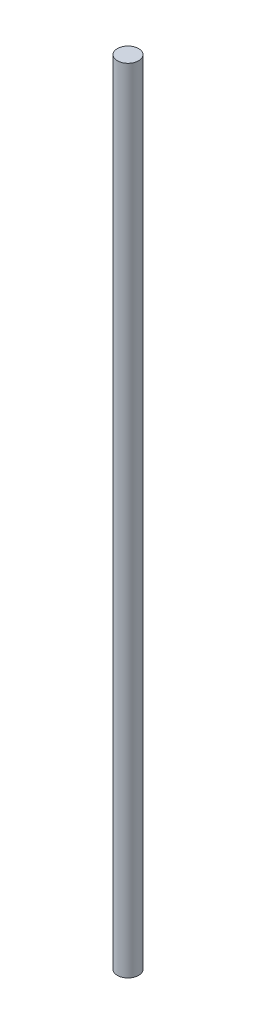
from build123d import *

# Parameters (mm, degrees)
AUFSATZ_LINEAR_AUSTRAGEN1_DEPTH      = 224
AUFSATZ_LINEAR_AUSTRAGEN1_DEPTH_BACK = 224
SKIZZE2_R                            = 6


with BuildPart() as part:
    # Skizze2 → Aufsatz-Linear austragen1 (new, two sides: drawn at the far end of the back side and taken through both)
    with BuildSketch(Plane(origin=(0, 0, 0), x_dir=(1, 0, 0), z_dir=(0, 1, 0)).offset(-AUFSATZ_LINEAR_AUSTRAGEN1_DEPTH_BACK)):
        Circle(SKIZZE2_R)
    extrude(amount=AUFSATZ_LINEAR_AUSTRAGEN1_DEPTH + AUFSATZ_LINEAR_AUSTRAGEN1_DEPTH_BACK)


solid = part.part
